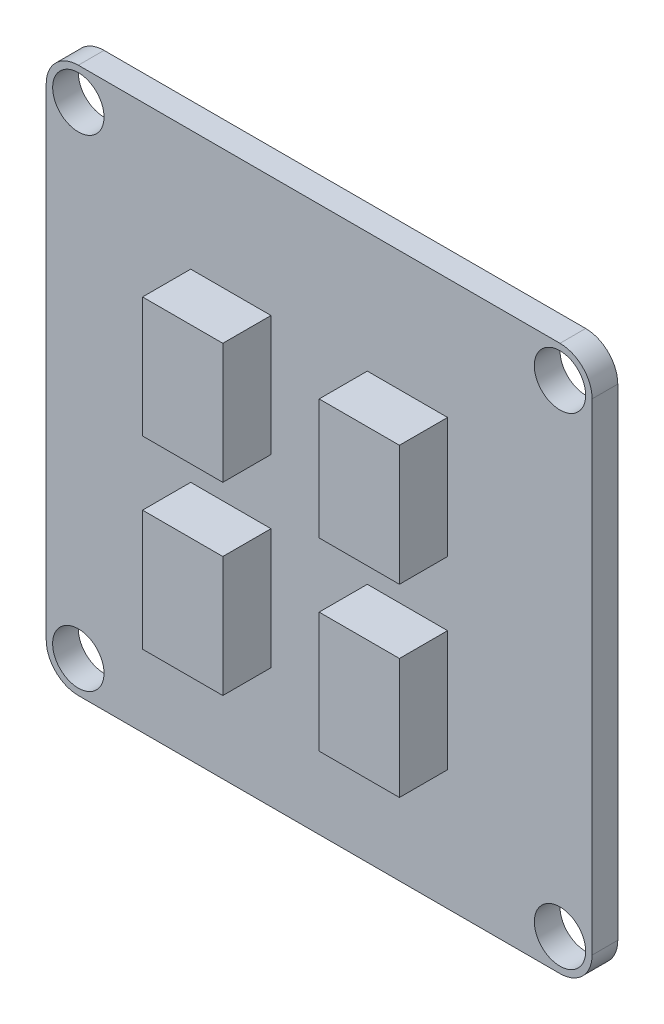
from build123d import *

# Parameters (mm, degrees)
SKETCH1_R           = 1.6
BOSS_EXTRUDE1_DEPTH = 1.6
SKETCH2_W           = 5
SKETCH2_H           = 7.5
BOSS_EXTRUDE2_DEPTH = 3


with BuildPart() as part:
    # Sketch1 → Boss-Extrude1 (new body)
    with BuildSketch(Plane.XY):
        with BuildLine():
            Line((-13.235657624, 13.611622239), (16.764342376, 13.611622239))
            ThreePointArc((16.764342376, 13.611622239), (18.178555938, 13.025835801), (18.764342376, 11.611622239))
            Line((18.764342376, 11.611622239), (18.764342376, -18.388377761))
            ThreePointArc((18.764342376, -18.388377761), (18.178555938, -19.802591324), (16.764342376, -20.388377761))
            Line((16.764342376, -20.388377761), (-13.235657624, -20.388377761))
            ThreePointArc((-13.235657624, -20.388377761), (-14.649871187, -19.802591324), (-15.235657624, -18.388377761))
            Line((-15.235657624, -18.388377761), (-15.235657624, 11.611622239))
            ThreePointArc((-15.235657624, 11.611622239), (-14.649871187, 13.025835801), (-13.235657624, 13.611622239))
        make_face()
        with Locations((16.764342376, 11.611622239)):
            Circle(SKETCH1_R, mode=Mode.SUBTRACT)
        with Locations(Location((16.764342376, -18.388377761, 0), (0, 0, 180))):
            Circle(SKETCH1_R, mode=Mode.SUBTRACT)
        with Locations(Location((-13.235657624, 11.611622239, 0), (0, 0, 180))):
            Circle(SKETCH1_R, mode=Mode.SUBTRACT)
        with Locations((-13.235657624, -18.388377761)):
            Circle(SKETCH1_R, mode=Mode.SUBTRACT)
    extrude(amount=BOSS_EXTRUDE1_DEPTH)

    # Sketch2 → Boss-Extrude2 (add)
    with BuildSketch(Plane.XY.offset(1.6)):
        with Locations((7.264342376, 2.361622239)):
            Rectangle(SKETCH2_W, SKETCH2_H)
        with Locations((7.264342376, -9.138377761)):
            Rectangle(SKETCH2_W, SKETCH2_H)
        with Locations((-3.735657624, -9.138377761)):
            Rectangle(SKETCH2_W, SKETCH2_H)
        with Locations((-3.735657624, 2.361622239)):
            Rectangle(SKETCH2_W, SKETCH2_H)
    extrude(amount=BOSS_EXTRUDE2_DEPTH)


solid = part.part
